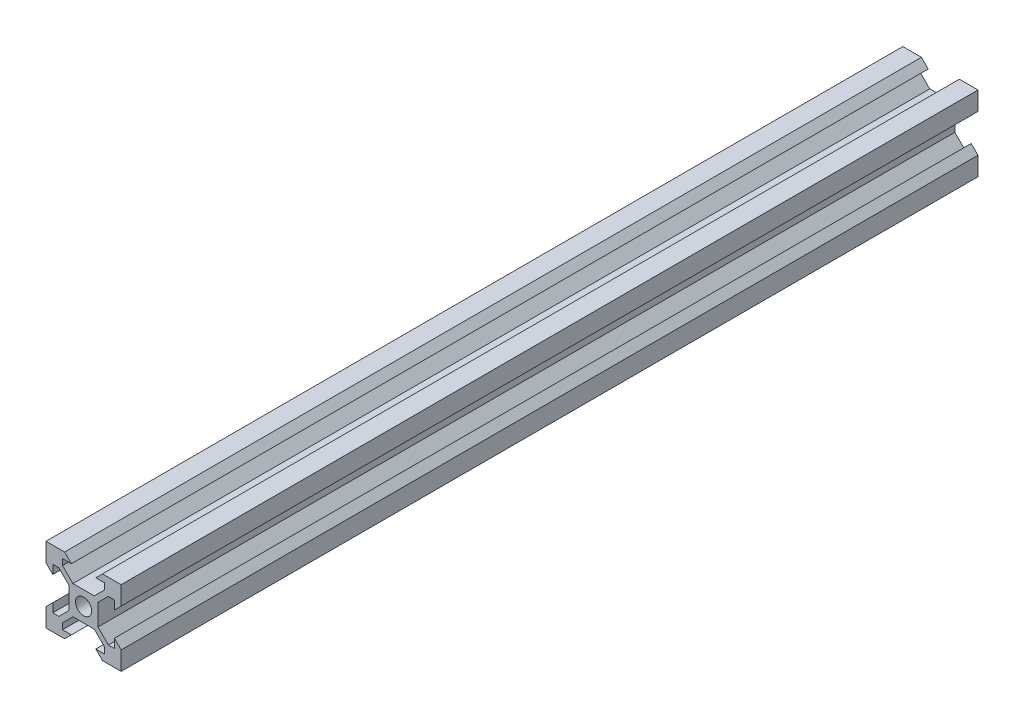
from build123d import *

# Parameters (mm, degrees)
CROQUIS1_R              = 1.075
SALIENTE_EXTRUIR1_DEPTH = 114


with BuildPart() as part:
    # Croquis1 → Saliente-Extruir1 (new body)
    with BuildSketch(Plane.XY):
        Polygon((-1.420025253, 1.915), (-2.8, 3.294974747), (-2.8, 4.1), (-1.625, 4.1), (-2.525, 5), (-5, 5), (-5, 2.52), (-4.1, 1.62), (-4.1, 2.8), (-3.294974747, 2.8), (-1.915, 1.420025253), (-1.915, -1.420025253), (-3.294974747, -2.8), (-4.1, -2.8), (-4.1, -1.625), (-5, -2.525), (-5, -5), (-2.52, -5), (-1.62, -4.1), (-2.8, -4.1), (-2.8, -3.294974747), (-1.420025253, -1.915), (1.420025253, -1.915), (2.8, -3.294974747), (2.8, -4.1), (1.625, -4.1), (2.525, -5), (5, -5), (5, -2.52), (4.1, -1.62), (4.1, -2.8), (3.294974747, -2.8), (1.915, -1.420025253), (1.915, 1.420025253), (3.294974747, 2.8), (4.1, 2.8), (4.1, 1.625), (5, 2.525), (5, 5), (2.52, 5), (1.62, 4.1), (2.8, 4.1), (2.8, 3.294974747), (1.420025253, 1.915), align=None)
        with Locations(Location((0, 0, 0), (0, 0, 180))):
            Circle(CROQUIS1_R, mode=Mode.SUBTRACT)
    extrude(amount=SALIENTE_EXTRUIR1_DEPTH)


solid = part.part
